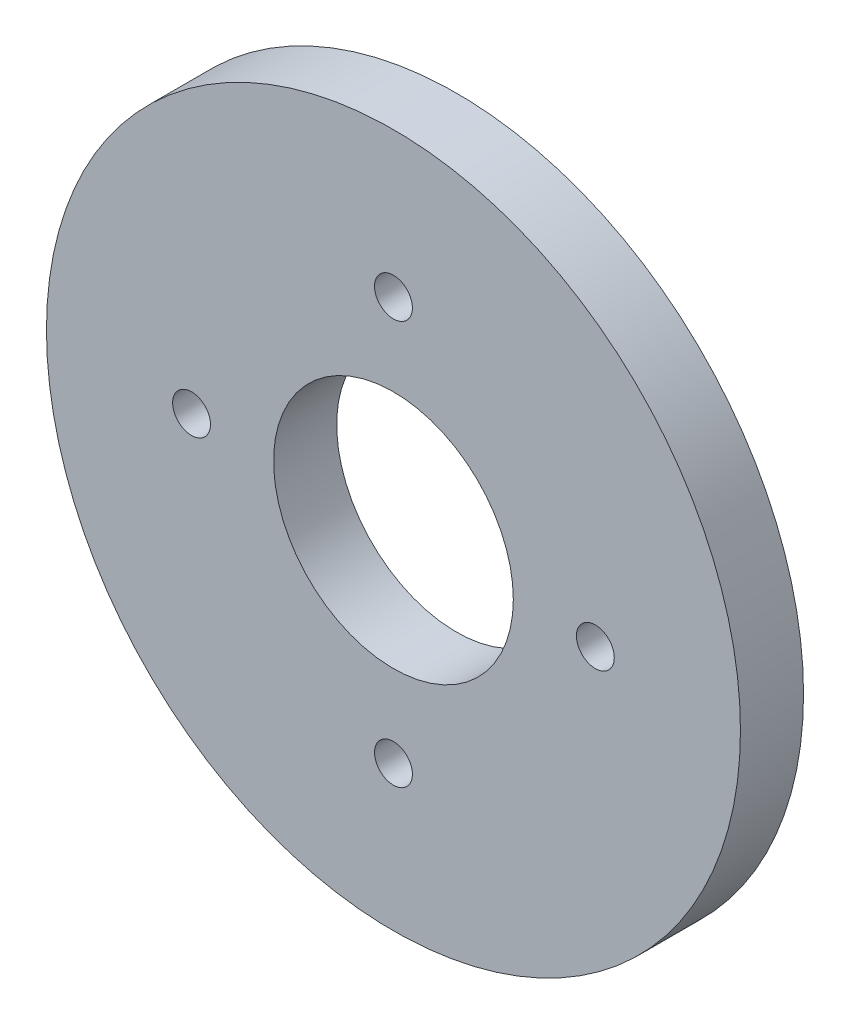
from build123d import *

# Parameters (mm, degrees)
ESQUISSE1_R             = 27.5
ESQUISSE1_R_2           = 9.5
BOSS_EXTRU_1_DEPTH      = 5
ESQUISSE2_R             = 1.5
ENL_V_MAT_EXTRU_2_DEPTH = 5


with BuildPart() as part:
    # Esquisse1 → Boss.-Extru.1 (new body)
    with BuildSketch(Plane.XY):
        Circle(ESQUISSE1_R)
        Circle(ESQUISSE1_R_2, mode=Mode.SUBTRACT)
    extrude(amount=BOSS_EXTRU_1_DEPTH)

    # Esquisse2 → Enlèv. mat.-Extru.2 (cut)
    with BuildSketch(Plane.XY.offset(5)):
        with Locations((16, 0)):
            Circle(ESQUISSE2_R)
        with Locations((0, 16)):
            Circle(ESQUISSE2_R)
        with Locations((0, -16)):
            Circle(ESQUISSE2_R)
        with Locations((-16, 0)):
            Circle(ESQUISSE2_R)
    extrude(amount=-ENL_V_MAT_EXTRU_2_DEPTH, mode=Mode.SUBTRACT)


solid = part.part
